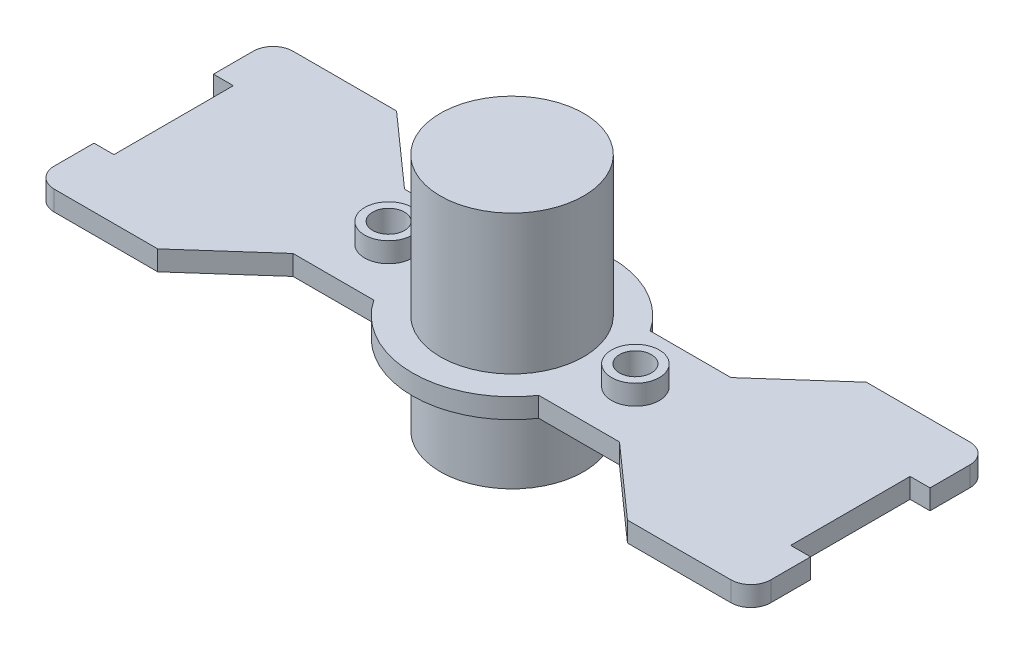
from build123d import *

# Parameters (mm, degrees)
EXTRUDE_1_DEPTH      = 5
EXTRUDE_2_DEPTH      = 35
EXTRUDE_2_DEPTH_BACK = 25
SKETCH_2_R           = 18
SKETCH_3_R           = 15
CUT_EXTRUDE_1_DEPTH  = 55
SKETCH_4_R           = 6
SKETCH_4_R_2         = 4
EXTRUDE_3_DEPTH      = 5
SKETCH_5_R           = 4
CUT_EXTRUDE_2_DEPTH  = 102.118742081
FILLET_1_R           = 5


with BuildPart() as part:
    # 草图1 → 凸台-拉伸1 (new body)
    with BuildSketch(Plane(origin=(0, 0, 0), x_dir=(1, 0, 0), z_dir=(0, 1, 0))):
        with BuildLine():
            Line((-20.712315177, 14), (-41, 14))
            Line((-41, 14), (-59, 30))
            Line((-59, 30), (-90, 30))
            Line((-90, 30), (-90, 15))
            Line((-90, 15), (-85, 15))
            Line((-85, 15), (-85, -15))
            Line((-85, -15), (-90, -15))
            Line((-90, -15), (-90, -30))
            Line((-90, -30), (-59, -30))
            Line((-59, -30), (-41, -14))
            Line((-41, -14), (-20.712315177, -14))
            ThreePointArc((-20.712315177, -14), (0, -25), (20.712315177, -14))
            Line((20.712315177, -14), (41, -14))
            Line((41, -14), (59, -30))
            Line((59, -30), (90, -30))
            Line((90, -30), (90, -15))
            Line((90, -15), (85, -15))
            Line((85, -15), (85, 15))
            Line((85, 15), (90, 15))
            Line((90, 15), (90, 30))
            Line((90, 30), (59, 30))
            Line((59, 30), (41, 14))
            Line((41, 14), (20.712315177, 14))
            ThreePointArc((20.712315177, 14), (0, 25), (-20.712315177, 14))
        make_face()
    extrude(amount=EXTRUDE_1_DEPTH)

    # 草图2 → 凸台-拉伸2 (add, two sides: drawn at the far end of the back side and taken through both)
    with BuildSketch(Plane(origin=(0, 5, 0), x_dir=(1, 0, 0), z_dir=(0, 1, 0)).offset(-EXTRUDE_2_DEPTH_BACK)):
        with Locations(Location((0, 0, 0), (0, 0, 270))):
            Circle(SKETCH_2_R)
    extrude(amount=EXTRUDE_2_DEPTH + EXTRUDE_2_DEPTH_BACK)

    # 草图3 → 切除-拉伸1 (cut)
    with BuildSketch(Plane.XZ.offset(20)):
        with Locations(Location((0, 0, 0), (0, 0, 270))):
            Circle(SKETCH_3_R)
    extrude(amount=-CUT_EXTRUDE_1_DEPTH, mode=Mode.SUBTRACT)

    # 草图4 → 凸台-拉伸3 (add)
    # profile 1 of 2: a face of its own
    with BuildSketch(Plane(origin=(0, 5, 0), x_dir=(1, 0, 0), z_dir=(0, 1, 0))):
        with Locations(Location((-31, 0, 0), (0, 0, 270))):
            Circle(SKETCH_4_R)
        with Locations(Location((-31, 0, 0), (0, 0, 270))):
            Circle(SKETCH_4_R_2, mode=Mode.SUBTRACT)
    # profile 2 of 2: a face of its own
    with BuildSketch(Plane(origin=(0, 5, 0), x_dir=(1, 0, 0), z_dir=(0, 1, 0))):
        with Locations(Location((31, 0, 0), (0, 0, 270))):
            Circle(SKETCH_4_R)
        with Locations(Location((31, 0, 0), (0, 0, 270))):
            Circle(SKETCH_4_R_2, mode=Mode.SUBTRACT)
    extrude(amount=EXTRUDE_3_DEPTH)

    # 草图5 → 切除-拉伸2 (cut, through all)
    with BuildSketch(Plane(origin=(0, 5, 0), x_dir=(1, 0, 0), z_dir=(0, 1, 0))):
        with Locations(Location((31, 0, 0), (0, 0, 270))):
            Circle(SKETCH_5_R)
        with Locations(Location((-31, 0, 0), (0, 0, 270))):
            Circle(SKETCH_5_R)
    extrude(amount=-CUT_EXTRUDE_2_DEPTH, mode=Mode.SUBTRACT)

    # 圆角1
    fillet_1_edges = [part.edges().sort_by_distance(p)[0] for p in [
        (-90, 2.5, -30),
        (90, 2.5, -30),
        (90, 2.5, 30),
        (-90, 2.5, 30),
    ]]
    fillet(fillet_1_edges, radius=FILLET_1_R)


solid = part.part
